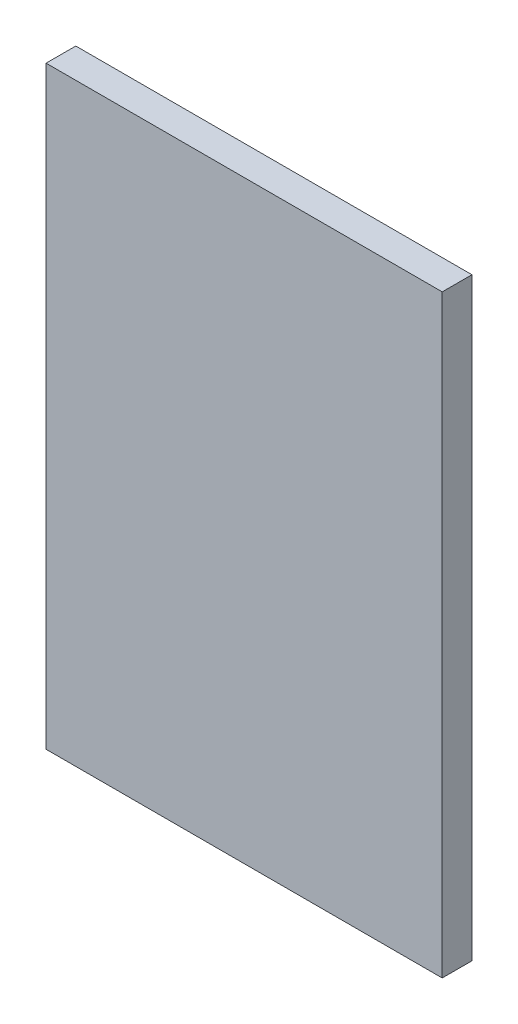
from build123d import *

# Parameters (mm, degrees)
SKETCH2_W           = 40
SKETCH2_H           = 60
BOSS_EXTRUDE1_DEPTH = 3


with BuildPart() as part:
    # Sketch2 → Boss-Extrude1 (new body)
    with BuildSketch(Plane.XY):
        with Locations((20, 30)):
            Rectangle(SKETCH2_W, SKETCH2_H)
    extrude(amount=BOSS_EXTRUDE1_DEPTH)


solid = part.part
